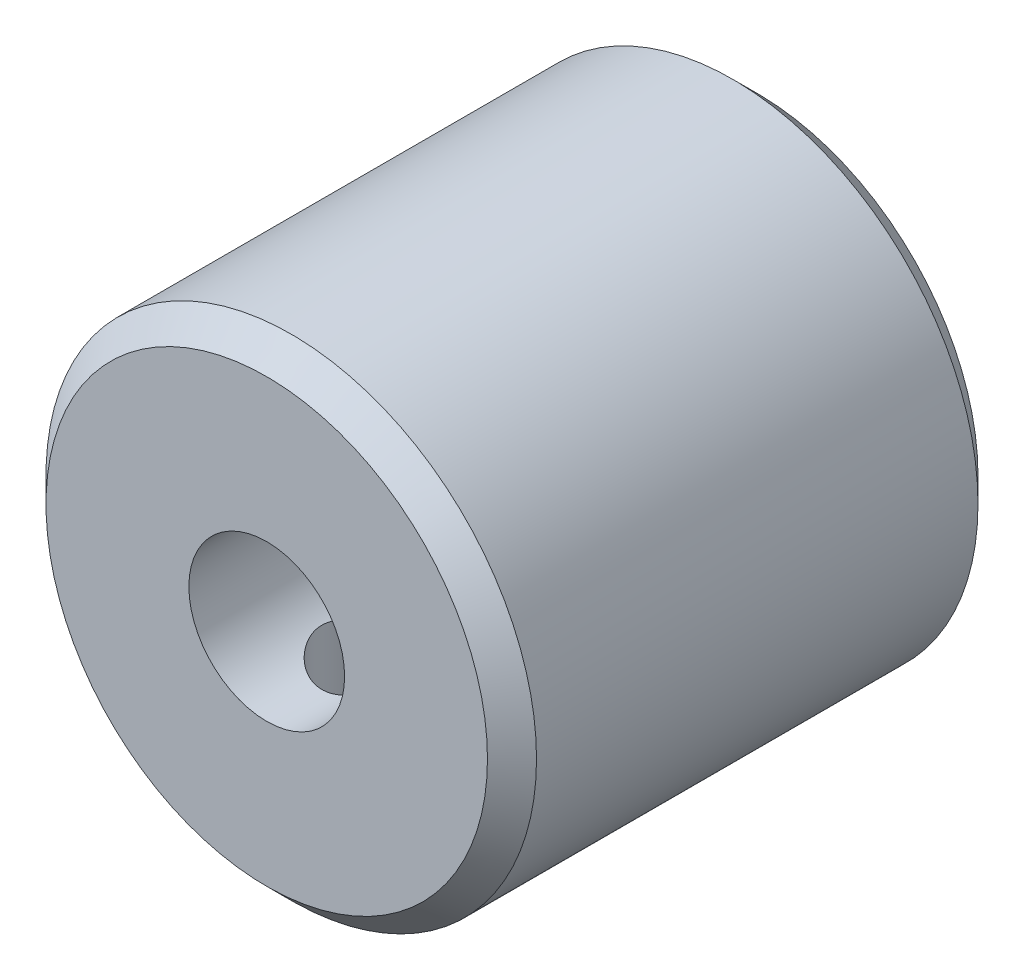
from build123d import *

# Parameters (mm, degrees)
SKETCH1_R                     = 5
SKETCH1_R_2                   = 1.5875
BOSS_EXTRUDE1_DEPTH           = 5
SKETCH2_R                     = 3.1
CUT_EXTRUDE1_DEPTH            = 5
CHAMFER1_SIZE                 = 0.5
M2_2X0_45_TAPPED_HOLE1_REACH  = 14.247
M2_2X0_45_TAPPED_HOLE1_BORE_R = 0.875


with BuildPart() as part:
    # Sketch1 → Boss-Extrude1 (new, symmetric)
    with BuildSketch(Plane.XY):
        Circle(SKETCH1_R)
        Circle(SKETCH1_R_2, mode=Mode.SUBTRACT)
    extrude(amount=BOSS_EXTRUDE1_DEPTH, both=True)

    # Sketch2 → Cut-Extrude1 (cut)
    with BuildSketch(Plane(origin=(0, 0, -5), x_dir=(-1, 0, 0), z_dir=(0, 0, -1))):
        Circle(SKETCH2_R)
    extrude(amount=-CUT_EXTRUDE1_DEPTH, mode=Mode.SUBTRACT)

    # Chamfer1
    chamfer1_edges = [part.edges().sort_by_distance(p)[0] for p in [
        (-5, 0, -5),
        (-5, 0, 5),
    ]]
    chamfer(chamfer1_edges, length=CHAMFER1_SIZE)

    # M2.2x0.45 Tapped Hole1 bore → M2.2x0.45 Tapped Hole1 (cut, up to next)
    with BuildSketch(Plane(origin=(0, -5, 0), x_dir=(-1, 0, 0), z_dir=(0, -1, 0)), mode=Mode.PRIVATE) as m2_2x0_45_tapped_hole1_sk1:
        with Locations((0, -3)):
            Circle(M2_2X0_45_TAPPED_HOLE1_BORE_R)
    m2_2x0_45_tapped_hole1_tool1 = extrude(m2_2x0_45_tapped_hole1_sk1.sketch, amount=-M2_2X0_45_TAPPED_HOLE1_REACH, mode=Mode.PRIVATE) & part.part
    # M2.2x0.45 Tapped Hole1 bore → M2.2x0.45 Tapped Hole1 (cut, up to next)
    with BuildSketch(Plane(origin=(0, -5, 0), x_dir=(-1, 0, 0), z_dir=(0, -1, 0)), mode=Mode.PRIVATE) as m2_2x0_45_tapped_hole1_sk2:
        with Locations((0, 3)):
            Circle(M2_2X0_45_TAPPED_HOLE1_BORE_R)
    m2_2x0_45_tapped_hole1_tool2 = extrude(m2_2x0_45_tapped_hole1_sk2.sketch, amount=-M2_2X0_45_TAPPED_HOLE1_REACH, mode=Mode.PRIVATE) & part.part
    add(m2_2x0_45_tapped_hole1_tool1.solids().sort_by_distance((0, -5, 3))[0], mode=Mode.SUBTRACT)
    add(m2_2x0_45_tapped_hole1_tool2.solids().sort_by_distance((0, -5, -3))[0], mode=Mode.SUBTRACT)


solid = part.part
